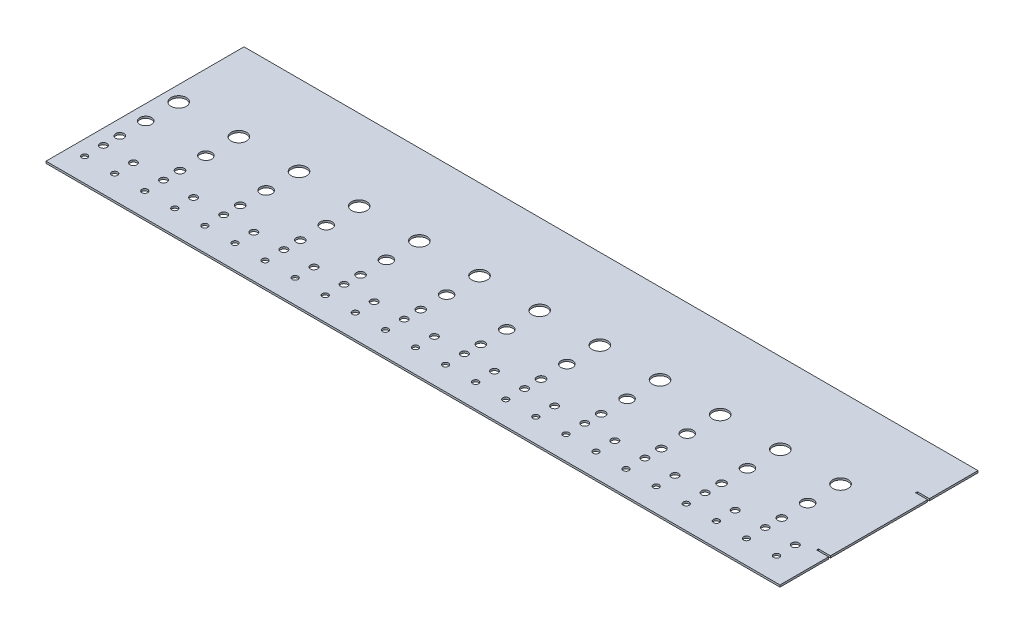
from build123d import *

# Parameters (mm, degrees)
SKETCH1_W           = 306.897159781
SKETCH1_H           = 84.168107
SKETCH1_R           = 1.25000004
SKETCH1_R_2         = 1.500000048
SKETCH1_R_3         = 1.750000056
SKETCH1_R_4         = 2.499999953
SKETCH1_R_5         = 3.249999977
BOSS_EXTRUDE1_DEPTH = 0.8382
SKETCH2_W           = 84.168107
SKETCH2_H           = 0.8382
BOSS_EXTRUDE2_DEPTH = 5.08
SKETCH3_W           = 10.16
SKETCH3_H           = 0.762
CUT_EXTRUDE2_DEPTH  = 5.08


with BuildPart() as part:
    # Sketch1 → Boss-Extrude1 (new body)
    with BuildSketch(Plane(origin=(0, 0, 0), x_dir=(1, 0, 0), z_dir=(0, 1, 0))):
        with Locations((153.448579891, 42.0840535)):
            Rectangle(SKETCH1_W, SKETCH1_H)
        with Locations(Location((6.393690829, 10.000000066, 0), (0, 0, 270))):
            Circle(SKETCH1_R, mode=Mode.SUBTRACT)
        with Locations(Location((19.181066829, 10.000000066, 0), (0, 0, 270))):
            Circle(SKETCH1_R, mode=Mode.SUBTRACT)
        with Locations(Location((31.968442829, 10.000000066, 0), (0, 0, 270))):
            Circle(SKETCH1_R, mode=Mode.SUBTRACT)
        with Locations(Location((44.755818829, 10.000000066, 0), (0, 0, 270))):
            Circle(SKETCH1_R, mode=Mode.SUBTRACT)
        with Locations(Location((57.543194829, 10.000000066, 0), (0, 0, 270))):
            Circle(SKETCH1_R, mode=Mode.SUBTRACT)
        with Locations(Location((70.330570829, 10.000000066, 0), (0, 0, 270))):
            Circle(SKETCH1_R, mode=Mode.SUBTRACT)
        with Locations(Location((83.117946829, 10.000000066, 0), (0, 0, 270))):
            Circle(SKETCH1_R, mode=Mode.SUBTRACT)
        with Locations(Location((95.905322829, 10.000000066, 0), (0, 0, 270))):
            Circle(SKETCH1_R, mode=Mode.SUBTRACT)
        with Locations(Location((108.692698829, 10.000000066, 0), (0, 0, 270))):
            Circle(SKETCH1_R, mode=Mode.SUBTRACT)
        with Locations(Location((121.480074829, 10.000000066, 0), (0, 0, 270))):
            Circle(SKETCH1_R, mode=Mode.SUBTRACT)
        with Locations(Location((134.267450829, 10.000000066, 0), (0, 0, 270))):
            Circle(SKETCH1_R, mode=Mode.SUBTRACT)
        with Locations(Location((147.054826829, 10.000000066, 0), (0, 0, 270))):
            Circle(SKETCH1_R, mode=Mode.SUBTRACT)
        with Locations(Location((159.842202829, 10.000000066, 0), (0, 0, 270))):
            Circle(SKETCH1_R, mode=Mode.SUBTRACT)
        with Locations(Location((172.629578829, 10.000000066, 0), (0, 0, 270))):
            Circle(SKETCH1_R, mode=Mode.SUBTRACT)
        with Locations(Location((185.416954829, 10.000000066, 0), (0, 0, 270))):
            Circle(SKETCH1_R, mode=Mode.SUBTRACT)
        with Locations(Location((198.204330829, 10.000000066, 0), (0, 0, 270))):
            Circle(SKETCH1_R, mode=Mode.SUBTRACT)
        with Locations(Location((210.991706829, 10.000000066, 0), (0, 0, 270))):
            Circle(SKETCH1_R, mode=Mode.SUBTRACT)
        with Locations(Location((223.779082829, 10.000000066, 0), (0, 0, 270))):
            Circle(SKETCH1_R, mode=Mode.SUBTRACT)
        with Locations(Location((236.566458829, 10.000000066, 0), (0, 0, 270))):
            Circle(SKETCH1_R, mode=Mode.SUBTRACT)
        with Locations(Location((249.353834829, 10.000000066, 0), (0, 0, 270))):
            Circle(SKETCH1_R, mode=Mode.SUBTRACT)
        with Locations(Location((262.141210829, 10.000000066, 0), (0, 0, 270))):
            Circle(SKETCH1_R, mode=Mode.SUBTRACT)
        with Locations(Location((274.928586829, 10.000000066, 0), (0, 0, 270))):
            Circle(SKETCH1_R, mode=Mode.SUBTRACT)
        with Locations(Location((287.715962829, 10.000000066, 0), (0, 0, 270))):
            Circle(SKETCH1_R, mode=Mode.SUBTRACT)
        with Locations(Location((300.503338829, 10.000000066, 0), (0, 0, 270))):
            Circle(SKETCH1_R, mode=Mode.SUBTRACT)
        with Locations(Location((6.393690829, 18.000000068, 0), (0, 0, 270))):
            Circle(SKETCH1_R_2, mode=Mode.SUBTRACT)
        with Locations(Location((19.181066829, 18.000000068, 0), (0, 0, 270))):
            Circle(SKETCH1_R_2, mode=Mode.SUBTRACT)
        with Locations(Location((31.968442829, 18.000000068, 0), (0, 0, 270))):
            Circle(SKETCH1_R_2, mode=Mode.SUBTRACT)
        with Locations(Location((44.755818829, 18.000000068, 0), (0, 0, 270))):
            Circle(SKETCH1_R_2, mode=Mode.SUBTRACT)
        with Locations(Location((57.543194829, 18.000000068, 0), (0, 0, 270))):
            Circle(SKETCH1_R_2, mode=Mode.SUBTRACT)
        with Locations(Location((70.330570829, 18.000000068, 0), (0, 0, 270))):
            Circle(SKETCH1_R_2, mode=Mode.SUBTRACT)
        with Locations(Location((83.117946829, 18.000000068, 0), (0, 0, 270))):
            Circle(SKETCH1_R_2, mode=Mode.SUBTRACT)
        with Locations(Location((95.905322829, 18.000000068, 0), (0, 0, 270))):
            Circle(SKETCH1_R_2, mode=Mode.SUBTRACT)
        with Locations(Location((108.692698829, 18.000000068, 0), (0, 0, 270))):
            Circle(SKETCH1_R_2, mode=Mode.SUBTRACT)
        with Locations(Location((121.480074829, 18.000000068, 0), (0, 0, 270))):
            Circle(SKETCH1_R_2, mode=Mode.SUBTRACT)
        with Locations(Location((134.267450829, 18.000000068, 0), (0, 0, 270))):
            Circle(SKETCH1_R_2, mode=Mode.SUBTRACT)
        with Locations(Location((147.054826829, 18.000000068, 0), (0, 0, 270))):
            Circle(SKETCH1_R_2, mode=Mode.SUBTRACT)
        with Locations(Location((159.842202829, 18.000000068, 0), (0, 0, 270))):
            Circle(SKETCH1_R_2, mode=Mode.SUBTRACT)
        with Locations(Location((172.629578829, 18.000000068, 0), (0, 0, 270))):
            Circle(SKETCH1_R_2, mode=Mode.SUBTRACT)
        with Locations(Location((185.416954829, 18.000000068, 0), (0, 0, 270))):
            Circle(SKETCH1_R_2, mode=Mode.SUBTRACT)
        with Locations(Location((198.204330829, 18.000000068, 0), (0, 0, 270))):
            Circle(SKETCH1_R_2, mode=Mode.SUBTRACT)
        with Locations(Location((210.991706829, 18.000000068, 0), (0, 0, 270))):
            Circle(SKETCH1_R_2, mode=Mode.SUBTRACT)
        with Locations(Location((223.779082829, 18.000000068, 0), (0, 0, 270))):
            Circle(SKETCH1_R_2, mode=Mode.SUBTRACT)
        with Locations(Location((236.566458829, 18.000000068, 0), (0, 0, 270))):
            Circle(SKETCH1_R_2, mode=Mode.SUBTRACT)
        with Locations(Location((249.353834829, 18.000000068, 0), (0, 0, 270))):
            Circle(SKETCH1_R_2, mode=Mode.SUBTRACT)
        with Locations(Location((262.141210829, 18.000000068, 0), (0, 0, 270))):
            Circle(SKETCH1_R_2, mode=Mode.SUBTRACT)
        with Locations(Location((274.928586829, 18.000000068, 0), (0, 0, 270))):
            Circle(SKETCH1_R_2, mode=Mode.SUBTRACT)
        with Locations(Location((287.715962829, 18.000000068, 0), (0, 0, 270))):
            Circle(SKETCH1_R_2, mode=Mode.SUBTRACT)
        with Locations(Location((300.503338829, 18.000000068, 0), (0, 0, 270))):
            Circle(SKETCH1_R_2, mode=Mode.SUBTRACT)
        with Locations(Location((6.393690829, 25.000000038, 0), (0, 0, 270))):
            Circle(SKETCH1_R_3, mode=Mode.SUBTRACT)
        with Locations(Location((31.968454144, 25.000000038, 0), (0, 0, 270))):
            Circle(SKETCH1_R_3, mode=Mode.SUBTRACT)
        with Locations(Location((57.543217459, 25.000000038, 0), (0, 0, 270))):
            Circle(SKETCH1_R_3, mode=Mode.SUBTRACT)
        with Locations(Location((83.117980774, 25.000000038, 0), (0, 0, 270))):
            Circle(SKETCH1_R_3, mode=Mode.SUBTRACT)
        with Locations(Location((108.692744089, 25.000000038, 0), (0, 0, 270))):
            Circle(SKETCH1_R_3, mode=Mode.SUBTRACT)
        with Locations(Location((134.267507404, 25.000000038, 0), (0, 0, 270))):
            Circle(SKETCH1_R_3, mode=Mode.SUBTRACT)
        with Locations(Location((159.842270719, 25.000000038, 0), (0, 0, 270))):
            Circle(SKETCH1_R_3, mode=Mode.SUBTRACT)
        with Locations(Location((185.417034034, 25.000000038, 0), (0, 0, 270))):
            Circle(SKETCH1_R_3, mode=Mode.SUBTRACT)
        with Locations(Location((210.991797349, 25.000000038, 0), (0, 0, 270))):
            Circle(SKETCH1_R_3, mode=Mode.SUBTRACT)
        with Locations(Location((236.566560664, 25.000000038, 0), (0, 0, 270))):
            Circle(SKETCH1_R_3, mode=Mode.SUBTRACT)
        with Locations(Location((262.14132398, 25.000000038, 0), (0, 0, 270))):
            Circle(SKETCH1_R_3, mode=Mode.SUBTRACT)
        with Locations(Location((287.716087295, 25.000000038, 0), (0, 0, 270))):
            Circle(SKETCH1_R_3, mode=Mode.SUBTRACT)
        with Locations(Location((6.393690829, 35.999999882, 0), (0, 0, 270))):
            Circle(SKETCH1_R_4, mode=Mode.SUBTRACT)
        with Locations(Location((31.968442829, 35.999999882, 0), (0, 0, 270))):
            Circle(SKETCH1_R_4, mode=Mode.SUBTRACT)
        with Locations(Location((57.543194829, 35.999999882, 0), (0, 0, 270))):
            Circle(SKETCH1_R_4, mode=Mode.SUBTRACT)
        with Locations(Location((83.117946829, 35.999999882, 0), (0, 0, 270))):
            Circle(SKETCH1_R_4, mode=Mode.SUBTRACT)
        with Locations(Location((108.692698829, 35.999999882, 0), (0, 0, 270))):
            Circle(SKETCH1_R_4, mode=Mode.SUBTRACT)
        with Locations(Location((134.267450829, 35.999999882, 0), (0, 0, 270))):
            Circle(SKETCH1_R_4, mode=Mode.SUBTRACT)
        with Locations(Location((159.842202829, 35.999999882, 0), (0, 0, 270))):
            Circle(SKETCH1_R_4, mode=Mode.SUBTRACT)
        with Locations(Location((185.416954829, 35.999999882, 0), (0, 0, 270))):
            Circle(SKETCH1_R_4, mode=Mode.SUBTRACT)
        with Locations(Location((210.991706829, 35.999999882, 0), (0, 0, 270))):
            Circle(SKETCH1_R_4, mode=Mode.SUBTRACT)
        with Locations(Location((236.566458829, 35.999999882, 0), (0, 0, 270))):
            Circle(SKETCH1_R_4, mode=Mode.SUBTRACT)
        with Locations(Location((262.141210829, 35.999999882, 0), (0, 0, 270))):
            Circle(SKETCH1_R_4, mode=Mode.SUBTRACT)
        with Locations(Location((287.715962829, 35.999999882, 0), (0, 0, 270))):
            Circle(SKETCH1_R_4, mode=Mode.SUBTRACT)
        with Locations(Location((6.393690829, 50.000000076, 0), (0, 0, 270))):
            Circle(SKETCH1_R_5, mode=Mode.SUBTRACT)
        with Locations(Location((31.968442829, 50.000000076, 0), (0, 0, 270))):
            Circle(SKETCH1_R_5, mode=Mode.SUBTRACT)
        with Locations(Location((57.543194829, 50.000000076, 0), (0, 0, 270))):
            Circle(SKETCH1_R_5, mode=Mode.SUBTRACT)
        with Locations(Location((83.117946829, 50.000000076, 0), (0, 0, 270))):
            Circle(SKETCH1_R_5, mode=Mode.SUBTRACT)
        with Locations(Location((108.692698829, 50.000000076, 0), (0, 0, 270))):
            Circle(SKETCH1_R_5, mode=Mode.SUBTRACT)
        with Locations(Location((134.267450829, 50.000000076, 0), (0, 0, 270))):
            Circle(SKETCH1_R_5, mode=Mode.SUBTRACT)
        with Locations(Location((159.842202829, 50.000000076, 0), (0, 0, 270))):
            Circle(SKETCH1_R_5, mode=Mode.SUBTRACT)
        with Locations(Location((185.416954829, 50.000000076, 0), (0, 0, 270))):
            Circle(SKETCH1_R_5, mode=Mode.SUBTRACT)
        with Locations(Location((210.991706829, 50.000000076, 0), (0, 0, 270))):
            Circle(SKETCH1_R_5, mode=Mode.SUBTRACT)
        with Locations(Location((236.566458829, 50.000000076, 0), (0, 0, 270))):
            Circle(SKETCH1_R_5, mode=Mode.SUBTRACT)
        with Locations(Location((262.141210829, 50.000000076, 0), (0, 0, 270))):
            Circle(SKETCH1_R_5, mode=Mode.SUBTRACT)
        with Locations(Location((287.715962829, 50.000000076, 0), (0, 0, 270))):
            Circle(SKETCH1_R_5, mode=Mode.SUBTRACT)
    extrude(amount=BOSS_EXTRUDE1_DEPTH)

    # Sketch2 → Boss-Extrude2 (add)
    with BuildSketch(Plane(origin=(306.897159781, 0, 0), x_dir=(0, 0, -1), z_dir=(1, 0, 0))):
        with Locations((42.0840535, 0.4191)):
            Rectangle(SKETCH2_W, SKETCH2_H)
    extrude(amount=BOSS_EXTRUDE2_DEPTH)

    # Sketch3 → Cut-Extrude2 (cut)
    with BuildSketch(Plane(origin=(0, 0.8382, 0), x_dir=(1, 0, 0), z_dir=(0, 1, 0))):
        with Locations((311.977159781, 21.04202675)):
            Rectangle(SKETCH3_W, SKETCH3_H)
        with Locations((311.977159781, 63.12608025)):
            Rectangle(SKETCH3_W, SKETCH3_H)
    extrude(amount=-CUT_EXTRUDE2_DEPTH, mode=Mode.SUBTRACT)


solid = part.part
